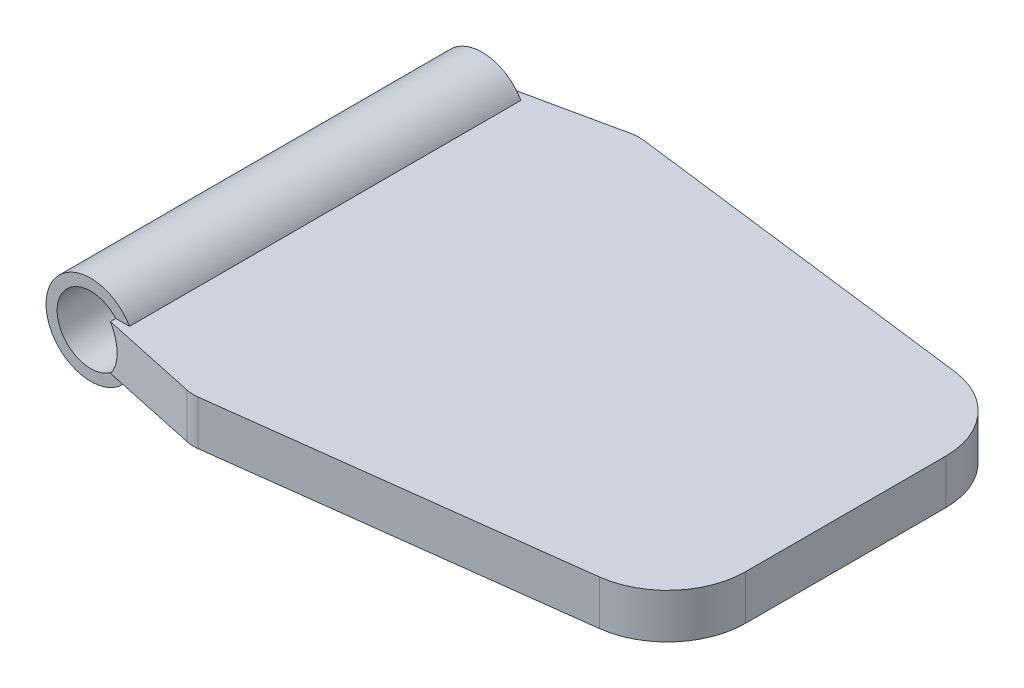
from build123d import *

# Parameters (mm, degrees)
BOSS_EXTRUDE1_DEPTH     = 10.16
SKETCH4_R               = 10.16
BOSS_EXTRUDE2_DEPTH     = 88.9
CUT_EXTRUDE1_DEPTH      = 160.369980112
CUT_EXTRUDE1_DEPTH_BACK = 160.369980112
SKETCH5_R               = 7.62


with BuildPart() as part:
    # Sketch1 → Boss-Extrude1 (new body)
    with BuildSketch(Plane(origin=(0, 0, 0), x_dir=(1, 0, 0), z_dir=(0, 1, 0))):
        with BuildLine():
            Line((0, 0), (27.899788868, 5.995845649))
            ThreePointArc((27.899788868, 5.995845649), (29.17117087, 6.158806163), (30.451880553, 6.106355894))
            Line((30.451880553, 6.106355894), (111.439136822, -4.081394546))
            ThreePointArc((111.439136822, -4.081394546), (122.553878894, -9.960729137), (127, -21.722364808))
            Line((127, -21.722364808), (127, -67.177635192))
            ThreePointArc((127, -67.177635192), (122.553878894, -78.939270863), (111.439136822, -84.818605454))
            Line((111.439136822, -84.818605454), (30.451880553, -95.006355894))
            ThreePointArc((30.451880553, -95.006355894), (29.17117087, -95.058806163), (27.899788868, -94.895845649))
            Line((27.899788868, -94.895845649), (0, -88.9))
            Line((0, -88.9), (0, 0))
        make_face()
    extrude(amount=BOSS_EXTRUDE1_DEPTH)

    # Sketch4 → Boss-Extrude2 (add)
    with BuildSketch(Plane.XY):
        with Locations((0, 5.08)):
            Circle(SKETCH4_R)
    extrude(amount=BOSS_EXTRUDE2_DEPTH)

    # Sketch5 → Cut-Extrude1 (cut, two sides: drawn at the far end of the back side and taken through both)
    with BuildSketch(Plane.XY.offset(-CUT_EXTRUDE1_DEPTH_BACK)):
        with Locations(Location((0, 5.08, 0), (0, 0, 41.810314896))):
            Circle(SKETCH5_R)
    extrude(amount=CUT_EXTRUDE1_DEPTH + CUT_EXTRUDE1_DEPTH_BACK, mode=Mode.SUBTRACT)


solid = part.part
